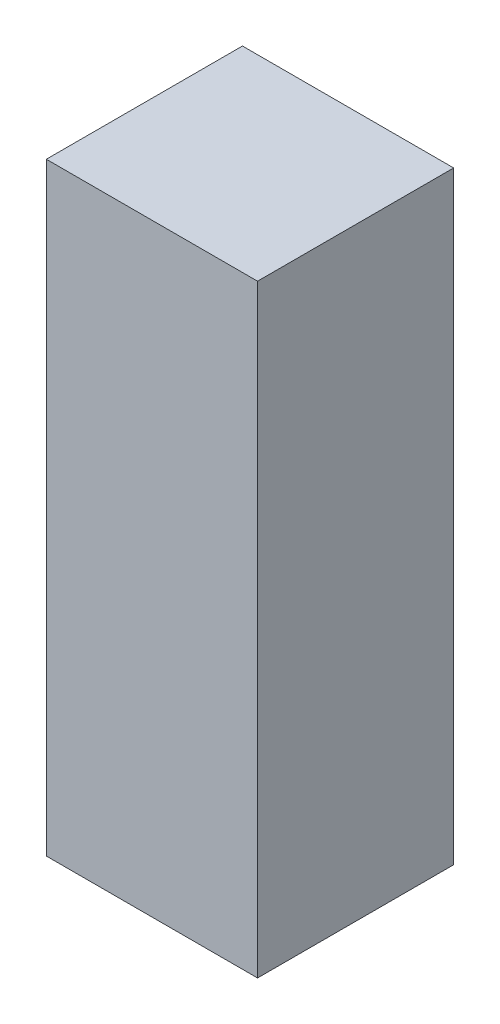
from build123d import *

# Parameters (mm, degrees)
PACK_SARJOR_KAPISI_MENTESE_2_1_START = 20
SKETCH1_W                            = 14
SKETCH1_H                            = 40
PACK_SARJOR_KAPISI_MENTESE_2_1_DEPTH = 13


with BuildPart() as part:
    # Sketch1 → PACK_sarjor_kapisi_mentese_2_1 (new body)
    with BuildSketch(Plane.XY.offset(PACK_SARJOR_KAPISI_MENTESE_2_1_START)):
        with Locations((31, 1890)):
            Rectangle(SKETCH1_W, SKETCH1_H)
    extrude(amount=PACK_SARJOR_KAPISI_MENTESE_2_1_DEPTH)


solid = part.part
